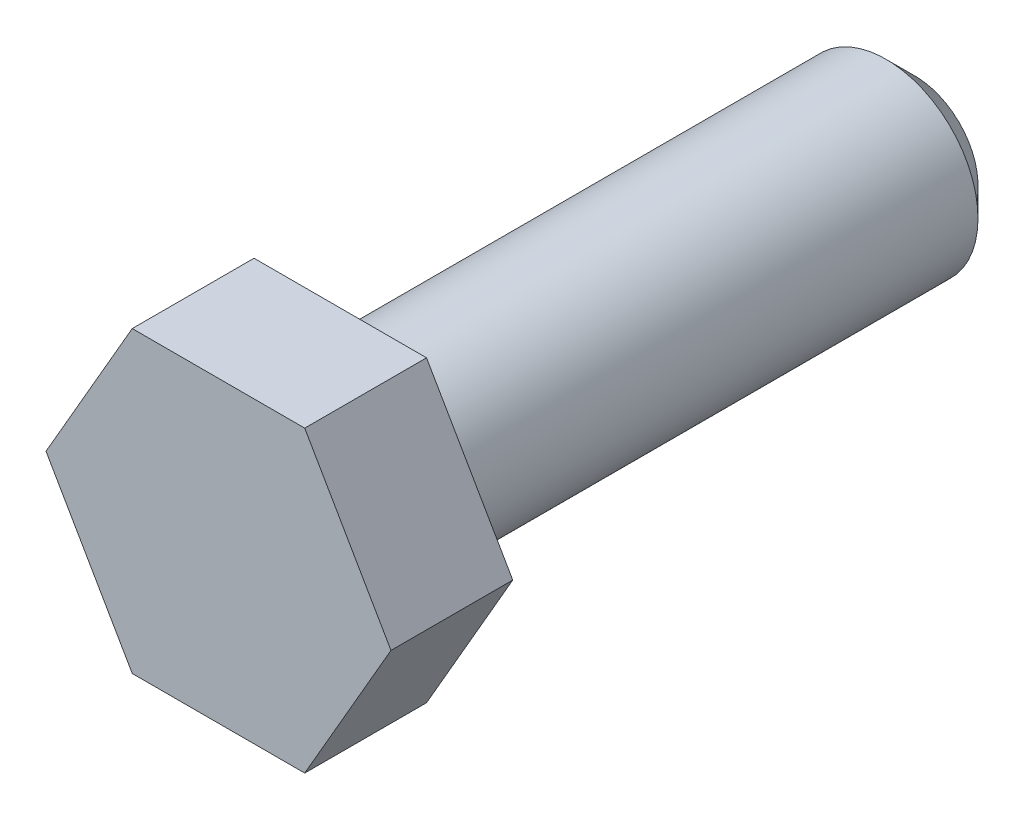
from build123d import *

# Parameters (mm, degrees)
BASE_EXTRUDE_DEPTH  = 5.3
SKETCH3_R           = 4
BOSS_EXTRUDE1_DEPTH = 25
CHAMFER1_SIZE       = 1.25


with BuildPart() as part:
    # Sketch1 → Base-Extrude (new body)
    with BuildSketch(Plane.XY):
        Polygon((-3.75277675, 6.5), (3.75277675, 6.5), (7.505553499, 0), (3.75277675, -6.5), (-3.75277675, -6.5), (-7.505553499, 0), align=None)
    extrude(amount=BASE_EXTRUDE_DEPTH)

    # Sketch3 → Boss-Extrude1 (add)
    with BuildSketch(Plane(origin=(0, 0, 0), x_dir=(-1, 0, 0), z_dir=(0, 0, -1))):
        with Locations(Location((0, 0, 0), (0, 0, 180))):
            Circle(SKETCH3_R)
    extrude(amount=BOSS_EXTRUDE1_DEPTH)

    # Chamfer1
    chamfer1_edges = [part.edges().sort_by_distance(p)[0] for p in [
        (-4, 0, -25),
    ]]
    chamfer(chamfer1_edges, length=CHAMFER1_SIZE)


solid = part.part
